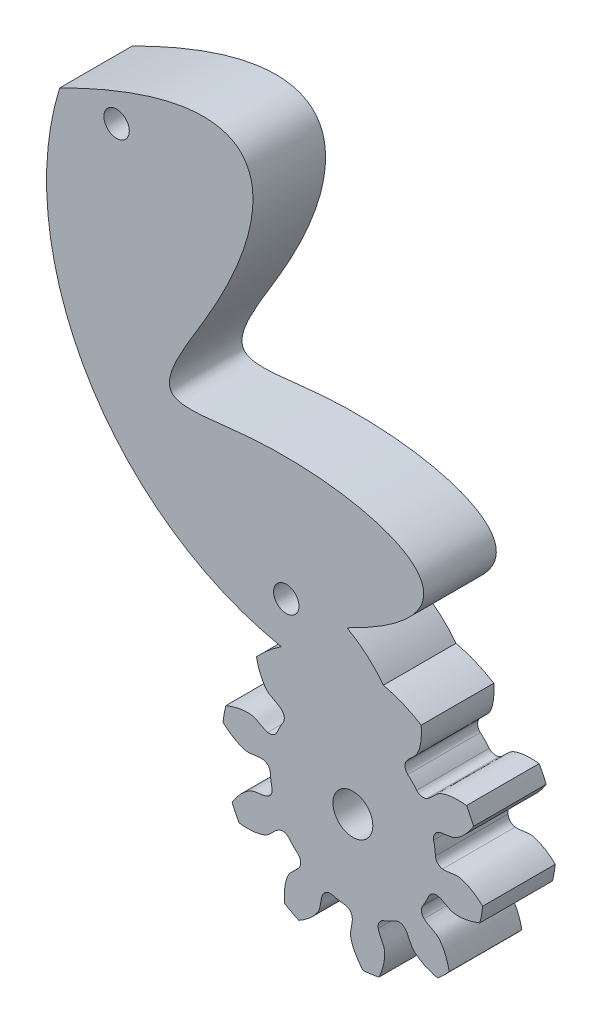
from build123d import *

# Parameters (mm, degrees)
SKETCH_1_R               = 5
SKETCH_1_R_2             = 1.75
EXTRUDE_1_DEPTH          = 1
SKETCH_1_2_R             = 5
SKETCH_1_2_R_2           = 1.75
EXTRUDE_1_2_DEPTH        = 10
SKETCH_8_R               = 18
EXTRUDE_3_DEPTH          = 10
CUT_EXTRUDE_3_DEPTH      = 10
SKETCH_9_R               = 2.75
CUT_EXTRUDE_4_DEPTH      = 10
PATTERN_CIRCULAR_3_COUNT = 8
PATTERN_CIRCULAR_3_ANGLE = 252


with BuildPart() as part:
    # 草图1 → Extrude 1 (new body)
    with BuildSketch(Plane.XY):
        with BuildLine():
            Line((-28.734789355, -54.994850358), (-28.734789355, -58.328015862))
            ThreePointArc((-28.734789355, -58.328015862), (-23.225990666, -76.076965568), (-15.040401528, -59.392595364))
            ThreePointArc((-15.040401528, -59.392595364), (-16.938502582, -50.630220181), (-23.251956138, -44.264506501))
            add(Edge.make_bspline(
                [(-62.838736191, 0.350021928), (-32.389159356, 15.612537319), (-31.850279348, -2.511107681), (-51.807104344, -30.749851579), (-24.547222921, -25.194338356), (-0.121629157, -33.001643525), (-23.251956138, -44.264506501)],
                knots=[0, 0, 0, 0, 0.4231554, 0.54312365, 0.634591279, 1, 1, 1, 1], degree=3))
            ThreePointArc((-62.838736191, 0.350021928), (-59.066198757, -32.022098209), (-32.569203506, -50.998279162))
            ThreePointArc((-32.569203506, -50.998279162), (-29.84841244, -52.225585419), (-28.734789355, -54.994850358))
        make_face()
        with Locations((-22.450945254, -66.107045578)):
            Circle(SKETCH_1_R, mode=Mode.SUBTRACT)
        with Locations((-31.620079453, -45.001895242)):
            Circle(SKETCH_1_R_2, mode=Mode.SUBTRACT)
        with Locations((-55, 0)):
            Circle(SKETCH_1_R_2, mode=Mode.SUBTRACT)
    extrude(amount=EXTRUDE_1_DEPTH)

    # 草图1<2> → Extrude 1 2 (add)
    with BuildSketch(Plane.XY):
        with BuildLine():
            Line((-28.734789355, -54.994850358), (-28.734789355, -58.328015862))
            ThreePointArc((-28.734789355, -58.328015862), (-23.225990666, -76.076965568), (-15.040401528, -59.392595364))
            ThreePointArc((-15.040401528, -59.392595364), (-16.938502582, -50.630220181), (-23.251956138, -44.264506501))
            add(Edge.make_bspline(
                [(-62.838736191, 0.350021928), (-32.389159356, 15.612537319), (-31.850279348, -2.511107681), (-51.807104344, -30.749851579), (-24.547222921, -25.194338356), (-0.121629157, -33.001643525), (-23.251956138, -44.264506501)],
                knots=[0, 0, 0, 0, 0.4231554, 0.54312365, 0.634591279, 1, 1, 1, 1], degree=3))
            ThreePointArc((-62.838736191, 0.350021928), (-59.066198757, -32.022098209), (-32.569203506, -50.998279162))
            ThreePointArc((-32.569203506, -50.998279162), (-29.84841244, -52.225585419), (-28.734789355, -54.994850358))
        make_face()
        with Locations((-22.450945254, -66.107045578)):
            Circle(SKETCH_1_2_R, mode=Mode.SUBTRACT)
        with Locations((-31.620079453, -45.001895242)):
            Circle(SKETCH_1_2_R_2, mode=Mode.SUBTRACT)
        with Locations((-55, 0)):
            Circle(SKETCH_1_2_R_2, mode=Mode.SUBTRACT)
    extrude(amount=EXTRUDE_1_2_DEPTH)

    # 草图8 → 凸台-拉伸3 (add)
    with BuildSketch(Plane.XY.offset(10)):
        with Locations((-22.450945254, -66.107045578)):
            Circle(SKETCH_8_R)
    extrude(amount=-EXTRUDE_3_DEPTH)

    # 草图7 → 切除-拉伸3 (cut)
    with BuildSketch(Plane.XY):
        with BuildLine():
            ThreePointArc((-32.074791242, -59.996269162), (-32.516547813, -60.755069762), (-32.898594881, -61.545618469))
            ThreePointArc((-32.898594881, -61.545618469), (-33.426235892, -62.105439742), (-34.189362041, -62.202616772))
            add(Edge.make_bspline(
                [(-34.189362041, -62.202616772), (-34.887904323, -62.048240162), (-35.514299704, -61.463375168), (-36.301484432, -61.27508526), (-36.418390308, -61.256365853), (-36.511856804, -61.244085562), (-36.620106269, -61.233415215), (-36.743105158, -61.225156125), (-36.880798237, -61.22027055), (-37.033079556, -61.219666468), (-37.199801921, -61.224264891), (-37.380774053, -61.234976094), (-37.575761733, -61.252704626), (-37.784487803, -61.278345394), (-38.006632614, -61.312782492), (-38.241834426, -61.356887219), (-38.48968992, -61.411516364), (-38.749754763, -61.477510428), (-39.021544252, -61.555691904), (-39.304534022, -61.646863561), (-39.598160821, -61.751806762), (-39.901823354, -61.871279822), (-40.214883184, -62.006016368), (-40.536665733, -62.156723828), (-40.866461212, -62.324081589), (-41.324360706, -62.574939195), (-41.664630607, -62.783295085), (-41.891067944, -62.931608295)],
                knots=[0.111785707, 0.111785707, 0.111785707, 0.111785707, 0.344235796, 0.363717055, 0.372294399, 0.382431261, 0.394127639, 0.407383534, 0.422198946, 0.438573875, 0.456508321, 0.476002284, 0.497055764, 0.519668761, 0.543841274, 0.569573305, 0.596864853, 0.625715918, 0.6561265, 0.688096598, 0.721626214, 0.756715347, 0.793363997, 0.831572163, 0.871339847, 0.912667048, 1, 1, 1, 1], degree=3))
            ThreePointArc((-41.891067944, -62.931608295), (-39.843035549, -56.859507132), (-35.954280723, -51.766135447))
            add(Edge.make_bspline(
                [(-32.251902799, -58.5587859), (-32.770506695, -58.065994407), (-33.605657603, -57.873741455), (-34.201945125, -57.326426119), (-34.282837152, -57.239974515), (-34.345283776, -57.169354329), (-34.414662227, -57.085578238), (-34.490289429, -56.988225963), (-34.571336747, -56.876805205), (-34.656992187, -56.750896068), (-34.746409884, -56.610105558), (-34.838728227, -56.454083233), (-34.933066334, -56.282517451), (-35.028527312, -56.095137561), (-35.124199466, -55.891714185), (-35.219158174, -55.672059995), (-35.312467594, -55.436030249), (-35.403182449, -55.18352331), (-35.490349821, -54.914481085), (-35.573010964, -54.628889389), (-35.65020313, -54.326778247), (-35.720961407, -54.008222111), (-35.784320584, -53.673340029), (-35.839316955, -53.322295664), (-35.884990374, -52.955297547), (-35.933074141, -52.43540387), (-35.950615794, -52.036796202), (-35.954280723, -51.766135447)],
                knots=[0.111785707, 0.111785707, 0.111785707, 0.111785707, 0.344235796, 0.363717055, 0.372294399, 0.382431261, 0.394127639, 0.407383534, 0.422198946, 0.438573875, 0.456508321, 0.476002284, 0.497055764, 0.519668761, 0.543841274, 0.569573305, 0.596864853, 0.625715918, 0.6561265, 0.688096598, 0.721626214, 0.756715347, 0.793363997, 0.831572163, 0.871339847, 0.912667048, 1, 1, 1, 1], degree=3))
            ThreePointArc((-32.251902799, -58.5587859), (-31.905731481, -59.245786856), (-32.074791242, -59.996269162))
        make_face()
    cut_extrude_3 = extrude(amount=CUT_EXTRUDE_3_DEPTH, mode=Mode.SUBTRACT)

    # 草图9 → 切除-拉伸4 (cut)
    with BuildSketch(Plane.XY.offset(10)):
        with Locations((-22.450945254, -66.107045578)):
            Circle(SKETCH_9_R)
    extrude(amount=-CUT_EXTRUDE_4_DEPTH, mode=Mode.SUBTRACT)

    # 阵列(圆周)3: 切除-拉伸3 ×8 about axis
    pattern_circular_3_axis = Axis((-22.450945254, -66.107045578, 0), (0, 0, 1))
    for i in range(1, PATTERN_CIRCULAR_3_COUNT):
        add(cut_extrude_3.rotate(pattern_circular_3_axis, i * PATTERN_CIRCULAR_3_ANGLE / (PATTERN_CIRCULAR_3_COUNT - 1)), mode=Mode.SUBTRACT)


solid = part.part
